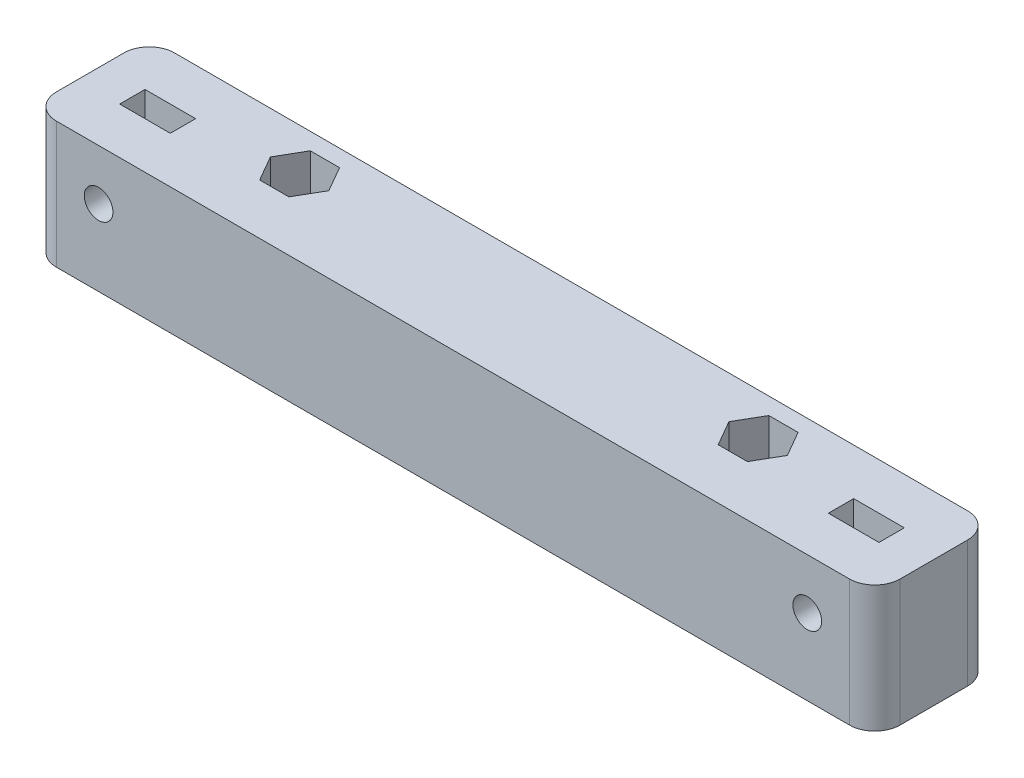
from build123d import *

# Parameters (mm, degrees)
SKETCH1_W           = 100
SKETCH1_H           = 14
SKETCH1_R           = 1.7
BOSS_EXTRUDE1_DEPTH = 15
SKETCH3_R           = 1.7
CUT_EXTRUDE2_DEPTH  = 55.046276467
CUT_EXTRUDE3_START  = -7
CUT_EXTRUDE3_DEPTH  = 1.5
CUT_EXTRUDE4_DEPTH  = 6
FILLET4_R           = 3


with BuildPart() as part:
    # Sketch1 → Boss-Extrude1 (new body)
    with BuildSketch(Plane(origin=(0, 0, 0), x_dir=(1, 0, 0), z_dir=(0, 1, 0))):
        Rectangle(SKETCH1_W, SKETCH1_H)
        with Locations(Location((-27.175, 2, 0), (0, 0, 270))):
            Circle(SKETCH1_R, mode=Mode.SUBTRACT)
        with Locations(Location((27.175, 2, 0), (0, 0, 270))):
            Circle(SKETCH1_R, mode=Mode.SUBTRACT)
    extrude(amount=BOSS_EXTRUDE1_DEPTH)

    # Sketch3 → Cut-Extrude2 (cut, through all)
    with BuildSketch(Plane.XY.offset(7)):
        with Locations((-42, 9)):
            Circle(SKETCH3_R)
        with Locations((42, 9)):
            Circle(SKETCH3_R)
    extrude(amount=-CUT_EXTRUDE2_DEPTH, mode=Mode.SUBTRACT)

    # Sketch4 → Cut-Extrude3 (cut, symmetric)
    with BuildSketch(Plane.XY.offset(7).offset(CUT_EXTRUDE3_START)):
        Polygon((-45, 10.732050808), (-45, 16.451909609), (-39, 16.451909609), (-39, 10.732050808), (-39, 7.267949192), (-42, 5.535898385), (-45, 7.267949192), align=None)
        Polygon((39, 16.451909609), (39, 10.732050808), (39, 7.267949192), (42, 5.535898385), (45, 7.267949192), (45, 10.732050808), (45, 16.451909609), align=None)
    extrude(amount=CUT_EXTRUDE3_DEPTH, both=True, mode=Mode.SUBTRACT)

    # Sketch5 → Cut-Extrude4 (cut)
    with BuildSketch(Plane(origin=(0, 15, 0), x_dir=(1, 0, 0), z_dir=(0, 1, 0))):
        Polygon((-23.710898385, 2), (-25.442949192, 5), (-28.907050808, 5), (-30.639101615, 2), (-28.907050808, -1), (-25.442949192, -1), align=None)
        Polygon((25.442949192, -1), (23.710898385, 2), (25.442949192, 5), (28.907050808, 5), (30.639101615, 2), (28.907050808, -1), align=None)
    extrude(amount=-CUT_EXTRUDE4_DEPTH, mode=Mode.SUBTRACT)

    # Fillet4
    fillet4_edges = [part.edges().sort_by_distance(p)[0] for p in [
        (50, 7.5, 7),
        (-50, 7.5, 7),
        (-50, 7.5, -7),
        (50, 7.5, -7),
    ]]
    fillet(fillet4_edges, radius=FILLET4_R)


solid = part.part
